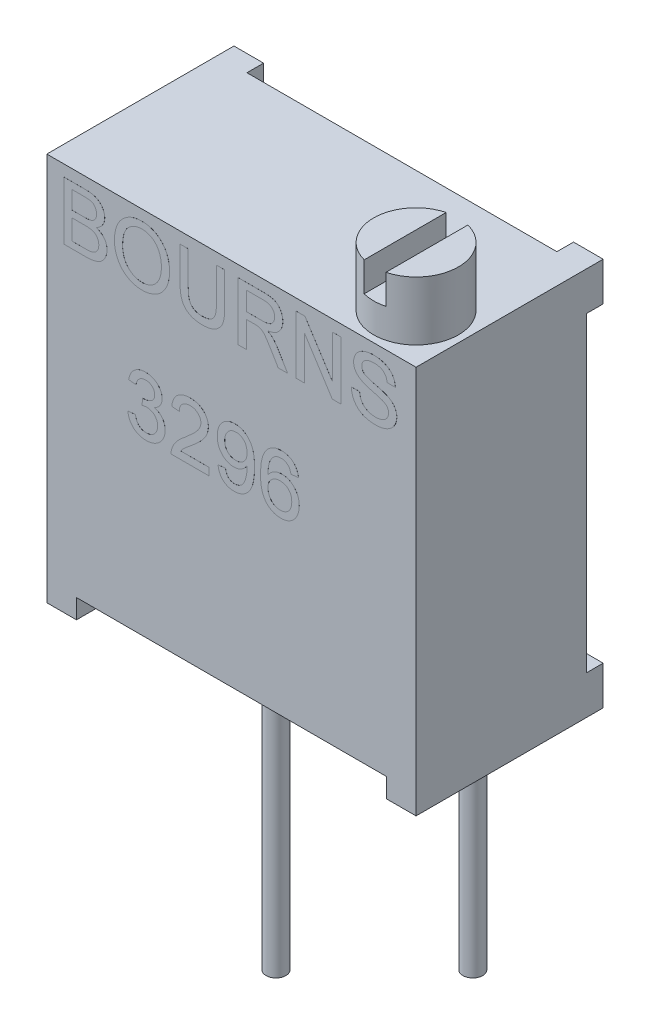
from build123d import *

# Parameters (mm, degrees)
SKETCH1_W          = 9.53
SKETCH1_H          = 10.03
EXTRUDE1_DEPTH     = 4.4
SKETCH2_W          = 8
SKETCH2_H          = 0.5
CUT_EXTRUDE1_DEPTH = 12.94429257
SKETCH3_W          = 0.765
SKETCH3_H          = 1
EXTRUDE2_DEPTH     = 0.43
SKETCH5_R          = 1.095
EXTRUDE4_DEPTH     = 1.52
SKETCH6_W          = 0.56
SKETCH6_H          = 3.177194403
CUT_EXTRUDE2_DEPTH = 0.76
EXTRUDE5_DEPTH     = 0.001
SKETCH9_R          = 0.255
EXTRUDE7_DEPTH     = 6.9


with BuildPart() as part:
    # Sketch1 → Extrude1 (new body)
    with BuildSketch(Plane.XY):
        with Locations((0, 5.015)):
            Rectangle(SKETCH1_W, SKETCH1_H)
    extrude(amount=EXTRUDE1_DEPTH)

    # Sketch2 → Cut-Extrude1 (cut, through all)
    with BuildSketch(Plane.XY.offset(4.4)):
        with Locations((0, 0.25)):
            Rectangle(SKETCH2_W, SKETCH2_H)
    extrude(amount=-CUT_EXTRUDE1_DEPTH, mode=Mode.SUBTRACT)

    # Sketch3 → Extrude2 (add)
    with BuildSketch(Plane(origin=(0, 0, 0), x_dir=(-1, 0, 0), z_dir=(0, 0, -1))):
        with Locations((-4.3825, 0.5)):
            Rectangle(SKETCH3_W, SKETCH3_H)
        with Locations((4.3825, 0.5)):
            Rectangle(SKETCH3_W, SKETCH3_H)
        with Locations((4.3825, 9.53)):
            Rectangle(SKETCH3_W, SKETCH3_H)
        with Locations((-4.3825, 9.53)):
            Rectangle(SKETCH3_W, SKETCH3_H)
    extrude(amount=EXTRUDE2_DEPTH)

    # Sketch5 → Extrude4 (add)
    with BuildSketch(Plane(origin=(0, 10.03, 0), x_dir=(-1, 0, 0), z_dir=(0, 1, 0))):
        with Locations(Location((-3.495, 3.13, 0), (0, 0, 270))):
            Circle(SKETCH5_R)
    extrude(amount=EXTRUDE4_DEPTH)

    # Sketch6 → Cut-Extrude2 (cut)
    with BuildSketch(Plane(origin=(0, 11.55, 0), x_dir=(-1, 0, 0), z_dir=(0, 1, 0))):
        with Locations((-3.495, 3.181606458)):
            Rectangle(SKETCH6_W, SKETCH6_H)
    extrude(amount=-CUT_EXTRUDE2_DEPTH, mode=Mode.SUBTRACT)

    # Sketch7 → Extrude5 (add)
    # profile 1 of 10: a face of its own
    with BuildSketch(Plane.XY.offset(4.4)):
        with BuildLine():
            Line((-4.326444342, 8.237150921), (-4.326444342, 9.737150921))
            Line((-4.326444342, 9.737150921), (-3.764845784, 9.737150921))
            add(Edge.make_bspline(
                [(-3.764845784, 9.737150921), (-3.750919069, 9.737097495), (-3.723744088, 9.736993245), (-3.684062996, 9.734386066), (-3.64648204, 9.730819986), (-3.610920315, 9.726223199), (-3.577531697, 9.719553354), (-3.5463473, 9.711473284), (-3.517204841, 9.702153183), (-3.481582627, 9.687955652), (-3.44053193, 9.666102632), (-3.396562734, 9.63349448), (-3.358307825, 9.594343785), (-3.326829661, 9.549455296), (-3.300895048, 9.501505925), (-3.282507712, 9.451409151), (-3.270751692, 9.400255705), (-3.269417834, 9.365618225), (-3.268752034, 9.348328806)],
                knots=[0, 0, 0, 0, 0.939712594, 1.833646414, 2.682508961, 3.487467313, 4.25240329, 4.978730417, 5.660668875, 6.315918528, 7.564895217, 8.787077865, 9.996481721, 11.241996224, 12.475862915, 13.665015424, 14.834484263, 16, 16, 16, 16], degree=3))
            add(Edge.make_bspline(
                [(-3.268752034, 9.348328806), (-3.26945193, 9.332243346), (-3.270844975, 9.300227505), (-3.281932051, 9.253066225), (-3.29943085, 9.207272915), (-3.324174647, 9.163404285), (-3.35580032, 9.122262901), (-3.395007125, 9.085240754), (-3.441231661, 9.052258501), (-3.475923175, 9.03467799), (-3.49381213, 9.025612459)],
                knots=[0, 0, 0, 0, 0.926741525, 1.844548388, 2.778836836, 3.746021974, 4.738420572, 5.759761325, 6.844803049, 8, 8, 8, 8], degree=3))
            add(Edge.make_bspline(
                [(-3.49381213, 9.025612459), (-3.482745904, 9.022148256), (-3.461080115, 9.015365935), (-3.429933293, 9.002955239), (-3.40069594, 8.988823885), (-3.373304413, 8.972948652), (-3.347943795, 8.955182527), (-3.324685642, 8.935497814), (-3.303368694, 8.914199128), (-3.284031035, 8.891299426), (-3.267044931, 8.866946071), (-3.251810517, 8.841671332), (-3.2392306, 8.815170846), (-3.228919301, 8.787513414), (-3.220874955, 8.758869935), (-3.215098238, 8.729130241), (-3.211805658, 8.698363557), (-3.211311122, 8.677463121), (-3.211059726, 8.666838421)],
                knots=[0, 0, 0, 0, 1.127427615, 2.20731145, 3.257257018, 4.283066884, 5.282973838, 6.264540225, 7.242620376, 8.210460609, 9.17525685, 10.12748095, 11.077310519, 12.023587065, 12.994999128, 13.967387486, 14.966724908, 16, 16, 16, 16], degree=3))
            add(Edge.make_bspline(
                [(-3.211059726, 8.666838421), (-3.211577892, 8.649780613), (-3.212604959, 8.615969962), (-3.220853456, 8.56620637), (-3.234792977, 8.518337989), (-3.253979542, 8.473138792), (-3.276841107, 8.43134548), (-3.302824076, 8.394052338), (-3.331265831, 8.36164311), (-3.362967261, 8.334381157), (-3.397723879, 8.311243736), (-3.436517359, 8.291760514), (-3.479047757, 8.27457818), (-3.526179479, 8.260852297), (-3.577891071, 8.249948474), (-3.634884306, 8.242864242), (-3.697246747, 8.237792882), (-3.74069542, 8.237370888), (-3.76334338, 8.237150921)],
                knots=[0, 0, 0, 0, 1.028073207, 2.037766189, 3.031549473, 4.027532207, 4.992436545, 5.898794514, 6.762903869, 7.584966804, 8.412380356, 9.273953678, 10.198004568, 11.174406109, 12.229717296, 13.381036288, 14.634844708, 16, 16, 16, 16], degree=3))
            Line((-3.76334338, 8.237150921), (-4.326444342, 8.237150921))
        make_face()
        with BuildLine():
            Line((-4.11490588, 9.102535536), (-3.805711169, 9.102535536))
            add(Edge.make_bspline(
                [(-3.805711169, 9.102535536), (-3.795593548, 9.102575565), (-3.776155313, 9.10265247), (-3.748116122, 9.103724756), (-3.722237293, 9.104639569), (-3.698618928, 9.106935678), (-3.677144021, 9.109184615), (-3.65789851, 9.112212035), (-3.640788132, 9.115623251), (-3.630311444, 9.11878741), (-3.625422707, 9.120263902)],
                knots=[0, 0, 0, 0, 1.335841395, 2.566453063, 3.705076039, 4.753984432, 5.69893722, 6.555639608, 7.326018133, 8, 8, 8, 8], degree=3))
            add(Edge.make_bspline(
                [(-3.625422707, 9.120263902), (-3.613935929, 9.124287721), (-3.591791825, 9.132044802), (-3.562116654, 9.149661914), (-3.536842034, 9.170802362), (-3.516035695, 9.195839435), (-3.500047055, 9.224639144), (-3.48819194, 9.256604254), (-3.481701001, 9.292181608), (-3.480773445, 9.316853252), (-3.480290496, 9.329698998)],
                knots=[0, 0, 0, 0, 1.059015028, 2.041559358, 2.989777133, 3.920090524, 4.862499371, 5.848878527, 6.879979022, 8, 8, 8, 8], degree=3))
            add(Edge.make_bspline(
                [(-3.480290496, 9.329698998), (-3.480678819, 9.342044591), (-3.481435618, 9.366104727), (-3.487788265, 9.401044217), (-3.498781285, 9.433548996), (-3.513668845, 9.463611935), (-3.532520451, 9.490357237), (-3.555020501, 9.513351936), (-3.581973973, 9.530734916), (-3.607167395, 9.541578455), (-3.629826882, 9.548362111), (-3.650072338, 9.552375722), (-3.673036723, 9.555912112), (-3.698795607, 9.558918633), (-3.727358734, 9.56125197), (-3.758814112, 9.563105652), (-3.793086864, 9.56389268), (-3.816828774, 9.564012054), (-3.829148669, 9.564073998)],
                knots=[0, 0, 0, 0, 1.216168307, 2.37017178, 3.484610845, 4.588286376, 5.664695412, 6.69777344, 7.738183022, 8.803673002, 9.390844981, 10.0665252, 10.835811589, 11.680682236, 12.621801058, 13.660007223, 14.785756265, 16, 16, 16, 16], degree=3))
            Line((-3.829148669, 9.564073998), (-4.11490588, 9.564073998))
            Line((-4.11490588, 9.564073998), (-4.11490588, 9.102535536))
        make_face(mode=Mode.SUBTRACT)
        with BuildLine():
            Line((-4.11490588, 8.410227844), (-3.760038092, 8.410227844))
            add(Edge.make_bspline(
                [(-3.760038092, 8.410227844), (-3.745915172, 8.410390096), (-3.719967473, 8.410688199), (-3.68447609, 8.41162336), (-3.655788079, 8.41390761), (-3.639035797, 8.416367164), (-3.631732803, 8.417439383)],
                knots=[0, 0, 0, 0, 1.317581857, 2.420761387, 3.311546315, 4, 4, 4, 4], degree=3))
            add(Edge.make_bspline(
                [(-3.631732803, 8.417439383), (-3.621262478, 8.419640139), (-3.60098922, 8.423901372), (-3.572408792, 8.433412), (-3.546204152, 8.444306931), (-3.522832664, 8.458153179), (-3.501191226, 8.47411003), (-3.482383206, 8.494040902), (-3.465060127, 8.516685746), (-3.450051204, 8.542600195), (-3.43791431, 8.571268479), (-3.42863829, 8.602247654), (-3.423697206, 8.635429101), (-3.422969697, 8.658209966), (-3.422598188, 8.669843229)],
                knots=[0, 0, 0, 0, 1.067651492, 2.067249321, 3.003744366, 3.895862395, 4.774133402, 5.679610569, 6.621910665, 7.616993802, 8.661192143, 9.724711987, 10.838102842, 12, 12, 12, 12], degree=3))
            add(Edge.make_bspline(
                [(-3.422598188, 8.669843229), (-3.42301209, 8.683501376), (-3.42381924, 8.710136157), (-3.431491485, 8.748624765), (-3.444164778, 8.784323428), (-3.462005081, 8.816737755), (-3.483887144, 8.845891651), (-3.51036223, 8.870622107), (-3.541232376, 8.890246947), (-3.576592458, 8.905648649), (-3.617921311, 8.916606694), (-3.666359943, 8.924041064), (-3.722683143, 8.928838285), (-3.762931606, 8.929242981), (-3.784377034, 8.929458613)],
                knots=[0, 0, 0, 0, 0.96167883, 1.875371887, 2.752872588, 3.621584364, 4.472914353, 5.312011319, 6.159851575, 7.038572308, 8.019870099, 9.164119506, 10.488969081, 12, 12, 12, 12], degree=3))
            Line((-3.784377034, 8.929458613), (-4.11490588, 8.929458613))
            Line((-4.11490588, 8.929458613), (-4.11490588, 8.410227844))
        make_face(mode=Mode.SUBTRACT)
    # profile 2 of 10: a face of its own
    with BuildSketch(Plane.XY.offset(4.4)):
        with BuildLine():
            add(Edge.make_bspline(
                [(-3.018752034, 8.96731919), (-3.018230692, 8.997392897), (-3.017214883, 9.055989991), (-3.007723632, 9.141314909), (-2.992312277, 9.221594495), (-2.970280381, 9.296822497), (-2.942354889, 9.367116795), (-2.90840612, 9.432636561), (-2.867412916, 9.492640158), (-2.821039156, 9.547698782), (-2.769241797, 9.596374641), (-2.714092331, 9.639605778), (-2.654902115, 9.675665657), (-2.592218021, 9.705439229), (-2.525773732, 9.728298516), (-2.455755803, 9.744302096), (-2.382239117, 9.754625961), (-2.331988742, 9.755787946), (-2.30631213, 9.75638169)],
                knots=[0, 0, 0, 0, 1.203621547, 2.345195544, 3.432004029, 4.472479546, 5.478447225, 6.455936844, 7.420185704, 8.381829745, 9.332027588, 10.260832629, 11.182364398, 12.100723901, 13.034044877, 13.989196293, 14.972532542, 16, 16, 16, 16], degree=3))
            add(Edge.make_bspline(
                [(-2.30631213, 9.75638169), (-2.289376641, 9.756085965), (-2.255745821, 9.755498707), (-2.206025657, 9.751030463), (-2.157583125, 9.74305542), (-2.110465931, 9.732367968), (-2.064545821, 9.718346497), (-2.019795371, 9.701794576), (-1.976606323, 9.681284416), (-1.934691352, 9.658321251), (-1.894545231, 9.632635958), (-1.856816008, 9.604261466), (-1.821594055, 9.573412372), (-1.788406246, 9.540595749), (-1.758360012, 9.504704083), (-1.730214065, 9.466830696), (-1.704777197, 9.426304031), (-1.681959152, 9.383456134), (-1.661557501, 9.338948785), (-1.644120351, 9.292597519), (-1.629147388, 9.24495835), (-1.616613755, 9.195749307), (-1.607620535, 9.144987212), (-1.600459136, 9.092890794), (-1.596689895, 9.039289785), (-1.596016226, 9.003081348), (-1.595675111, 8.984747075)],
                knots=[0, 0, 0, 0, 1.034375294, 2.054082248, 3.045783978, 4.031219655, 5.002789406, 5.976610191, 6.94273282, 7.920236376, 8.894345378, 9.851183672, 10.800797181, 11.752517031, 12.698794154, 13.65688337, 14.632873302, 15.61821402, 16.620222298, 17.621258913, 18.640965868, 19.669244166, 20.720417492, 21.788124603, 22.880008887, 24, 24, 24, 24], degree=3))
            add(Edge.make_bspline(
                [(-1.595675111, 8.984747075), (-1.595987646, 8.966110469), (-1.596605114, 8.929290641), (-1.600783152, 8.87489649), (-1.608129594, 8.822063882), (-1.617873399, 8.77063528), (-1.630929801, 8.720717747), (-1.646445328, 8.672168168), (-1.665212234, 8.625275712), (-1.686407371, 8.579927361), (-1.71038966, 8.536746809), (-1.736843752, 8.496035998), (-1.765788388, 8.458175743), (-1.796783902, 8.422701596), (-1.830554122, 8.390247902), (-1.866683213, 8.360511195), (-1.90503226, 8.333211022), (-1.945730096, 8.30908676), (-1.988046343, 8.287940982), (-2.031143628, 8.269180868), (-2.075053966, 8.253181495), (-2.119927428, 8.240215594), (-2.165641605, 8.230417626), (-2.21206785, 8.223080805), (-2.259358356, 8.218856237), (-2.291179863, 8.218233784), (-2.307213572, 8.217920152)],
                knots=[0, 0, 0, 0, 1.141429366, 2.255090526, 3.338676798, 4.407031443, 5.458968682, 6.496860253, 7.526652771, 8.550250826, 9.560787671, 10.54935636, 11.521089193, 12.477323897, 13.431786008, 14.386110112, 15.340986122, 16.312041, 17.28047646, 18.236612773, 19.189437236, 20.140779471, 21.09494583, 22.051062463, 23.018000708, 24, 24, 24, 24], degree=3))
            add(Edge.make_bspline(
                [(-2.307213572, 8.217920152), (-2.324453371, 8.218175217), (-2.358601094, 8.218680436), (-2.409072348, 8.223723391), (-2.458287957, 8.231416594), (-2.506104842, 8.242523255), (-2.552457663, 8.25701268), (-2.597401266, 8.27455022), (-2.641093722, 8.294901493), (-2.682992881, 8.318649222), (-2.722956135, 8.345054144), (-2.760596145, 8.373985002), (-2.795892098, 8.405175171), (-2.828277639, 8.439140188), (-2.858801633, 8.474648809), (-2.886243593, 8.513020865), (-2.911499732, 8.55338612), (-2.933822678, 8.596133677), (-2.95398812, 8.639993241), (-2.97097794, 8.68497884), (-2.985908699, 8.730427507), (-2.997799537, 8.776619369), (-3.007275088, 8.823447871), (-3.01364671, 8.870835093), (-3.018248343, 8.918851609), (-3.018583292, 8.951082028), (-3.018752034, 8.96731919)],
                knots=[0, 0, 0, 0, 1.072727997, 2.12480551, 3.153819198, 4.171534612, 5.177148798, 6.173931848, 7.17235114, 8.174500385, 9.168706755, 10.151274001, 11.127173509, 12.097141049, 13.070188938, 14.039134204, 15.03036519, 16.031505612, 17.038625933, 18.033164522, 19.022845559, 20.014762458, 21.000193215, 21.994692725, 22.989758729, 24, 24, 24, 24], degree=3))
        make_face()
        with BuildLine():
            add(Edge.make_bspline(
                [(-2.807213572, 8.964915344), (-2.8068894, 8.943259561), (-2.806257286, 8.901032314), (-2.799025562, 8.839467232), (-2.788052575, 8.781377442), (-2.772927471, 8.726599873), (-2.752595628, 8.675676265), (-2.728286277, 8.628117292), (-2.699180916, 8.584239101), (-2.665921697, 8.544164434), (-2.629340369, 8.508164356), (-2.590249507, 8.476720203), (-2.548640324, 8.450387949), (-2.504974133, 8.428645052), (-2.458937298, 8.411672739), (-2.410667702, 8.399755208), (-2.360129877, 8.39230176), (-2.325669313, 8.391437388), (-2.308115015, 8.390997075)],
                knots=[0, 0, 0, 0, 1.215430442, 2.370003584, 3.475209778, 4.53279855, 5.55522989, 6.548792651, 7.526809858, 8.505409025, 9.467826767, 10.404123909, 11.316848639, 12.227335424, 13.138360512, 14.065900994, 15.014765094, 16, 16, 16, 16], degree=3))
            add(Edge.make_bspline(
                [(-2.308115015, 8.390997075), (-2.290263171, 8.3914439), (-2.25530931, 8.392318784), (-2.204009559, 8.399642118), (-2.155269053, 8.412109783), (-2.108604686, 8.42870707), (-2.064860106, 8.451143772), (-2.02301225, 8.477417027), (-1.984201898, 8.509522192), (-1.947476365, 8.54558594), (-1.914536035, 8.586579013), (-1.885308427, 8.631491621), (-1.861565976, 8.680997339), (-1.841067574, 8.734005623), (-1.826057462, 8.791518352), (-1.81496407, 8.85288172), (-1.808278957, 8.918293114), (-1.80757498, 8.963196823), (-1.807213572, 8.986249479)],
                knots=[0, 0, 0, 0, 0.976878588, 1.912725521, 2.8289017, 3.727303729, 4.617335839, 5.514666588, 6.426584173, 7.368641557, 8.327632997, 9.299405846, 10.294892156, 11.327373912, 12.405931897, 13.542618837, 14.738430195, 16, 16, 16, 16], degree=3))
            add(Edge.make_bspline(
                [(-1.807213572, 8.986249479), (-1.807341294, 9.001080057), (-1.807591837, 9.030172285), (-1.810909864, 9.073054562), (-1.815189695, 9.114602954), (-1.821705802, 9.15476385), (-1.830685826, 9.193370934), (-1.840634167, 9.230718122), (-1.853074219, 9.266483577), (-1.867189192, 9.300807558), (-1.882983608, 9.333513851), (-1.900797609, 9.36432673), (-1.920424159, 9.3931264), (-1.941333711, 9.420458875), (-1.964684118, 9.445266276), (-1.989351045, 9.468596479), (-2.015894798, 9.489967476), (-2.044050482, 9.509384851), (-2.073418672, 9.526863548), (-2.103938825, 9.541823045), (-2.135124711, 9.554963084), (-2.167498339, 9.565035475), (-2.200612691, 9.573159006), (-2.234601633, 9.579329585), (-2.269591323, 9.582524997), (-2.293185557, 9.583042977), (-2.305110207, 9.583304767)],
                knots=[0, 0, 0, 0, 1.220438779, 2.394059227, 3.538503547, 4.658058814, 5.74010225, 6.800155734, 7.837851593, 8.854470756, 9.853724944, 10.825214244, 11.781044712, 12.72106398, 13.654479919, 14.581868691, 15.514082315, 16.456304431, 17.39516604, 18.324312202, 19.252140633, 20.177768678, 21.111585046, 22.057694709, 23.018348693, 24, 24, 24, 24], degree=3))
            add(Edge.make_bspline(
                [(-2.305110207, 9.583304767), (-2.321964073, 9.582970056), (-2.355218629, 9.582309634), (-2.404173295, 9.574968014), (-2.4513709, 9.56399863), (-2.496884691, 9.548662848), (-2.540325395, 9.528355862), (-2.581918075, 9.503452123), (-2.622031926, 9.47462972), (-2.660034411, 9.441186401), (-2.695461039, 9.402768193), (-2.725410699, 9.357474302), (-2.750653091, 9.30638599), (-2.771730023, 9.249632752), (-2.787800563, 9.186775074), (-2.798907316, 9.11808346), (-2.805919894, 9.043485528), (-2.806771322, 8.991774955), (-2.807213572, 8.964915344)],
                knots=[0, 0, 0, 0, 0.895090134, 1.766112571, 2.624765742, 3.468151641, 4.313618154, 5.168136083, 6.041303099, 6.935189387, 7.854749729, 8.809996334, 9.809869957, 10.877771942, 12.021723904, 13.25217762, 14.572720513, 16, 16, 16, 16], degree=3))
        make_face(mode=Mode.SUBTRACT)
    # profile 3 of 10: a face of its own
    with BuildSketch(Plane.XY.offset(4.4)):
        with BuildLine():
            Line((-0.384136649, 9.737150921), (-0.172598188, 9.737150921))
            Line((-0.172598188, 9.737150921), (-0.172598188, 8.874170152))
            add(Edge.make_bspline(
                [(-0.172598188, 8.874170152), (-0.172817713, 8.855839279), (-0.17324491, 8.820167371), (-0.175210197, 8.768143941), (-0.179038667, 8.719011196), (-0.184899968, 8.672848597), (-0.19152619, 8.629455925), (-0.200351288, 8.589070404), (-0.210472953, 8.551529041), (-0.222118871, 8.516578197), (-0.236215171, 8.483981753), (-0.252320236, 8.453041696), (-0.27110134, 8.423667691), (-0.292509773, 8.395904321), (-0.316659126, 8.369903341), (-0.342889972, 8.34499824), (-0.371894747, 8.32187367), (-0.403354379, 8.300264922), (-0.437307933, 8.280653275), (-0.473904053, 8.263733066), (-0.513098094, 8.24978275), (-0.554713075, 8.237914738), (-0.59895675, 8.229115881), (-0.645687182, 8.222441781), (-0.694966239, 8.218516166), (-0.728680904, 8.218121765), (-0.745915496, 8.217920152)],
                knots=[0, 0, 0, 0, 1.311435591, 2.552055809, 3.723716842, 4.835547674, 5.880436826, 6.862821995, 7.791032428, 8.661143393, 9.495683908, 10.328993084, 11.1538804, 11.986573222, 12.833449924, 13.690091648, 14.571895854, 15.484149563, 16.418232274, 17.373591634, 18.364096258, 19.391643703, 20.466661433, 21.588422397, 22.767226238, 24, 24, 24, 24], degree=3))
            add(Edge.make_bspline(
                [(-0.745915496, 8.217920152), (-0.762747176, 8.218167913), (-0.795542393, 8.218650658), (-0.843600901, 8.221914973), (-0.889315102, 8.227699697), (-0.932822961, 8.235291305), (-0.973978437, 8.245579942), (-1.01272043, 8.258173326), (-1.049181209, 8.272904412), (-1.083365134, 8.2896649), (-1.11487259, 8.309015777), (-1.144260591, 8.330138013), (-1.171397739, 8.353261603), (-1.19603194, 8.378594967), (-1.218455258, 8.405756623), (-1.238355176, 8.435036855), (-1.255779343, 8.466487887), (-1.271165901, 8.500026899), (-1.284571795, 8.536147585), (-1.295381776, 8.575342209), (-1.305161568, 8.617510171), (-1.312667758, 8.662804669), (-1.319261137, 8.711168829), (-1.323084681, 8.762745583), (-1.325997838, 8.817446196), (-1.326292931, 8.854934905), (-1.326444342, 8.874170152)],
                knots=[0, 0, 0, 0, 1.192889473, 2.324252067, 3.41162405, 4.457325556, 5.452435892, 6.415456921, 7.342133401, 8.237363544, 9.110250727, 9.959377435, 10.800155199, 11.633438097, 12.46053001, 13.293359256, 14.138649731, 15.005774073, 15.906391469, 16.865847877, 17.8852706, 18.972920589, 20.118424796, 21.343408205, 22.636917643, 24, 24, 24, 24], degree=3))
            Line((-1.326444342, 8.874170152), (-1.326444342, 9.737150921))
            Line((-1.326444342, 9.737150921), (-1.11490588, 9.737150921))
            Line((-1.11490588, 9.737150921), (-1.11490588, 8.884086017))
            add(Edge.make_bspline(
                [(-1.11490588, 8.884086017), (-1.114767658, 8.868560422), (-1.114500957, 8.838603557), (-1.113109482, 8.795207672), (-1.110326775, 8.754936554), (-1.106886612, 8.717728723), (-1.102157025, 8.683718544), (-1.09610028, 8.652955825), (-1.089306625, 8.625335805), (-1.079133218, 8.593035516), (-1.062246323, 8.556979041), (-1.035633784, 8.518762127), (-1.003161194, 8.485560874), (-0.964517851, 8.458141879), (-0.920633994, 8.436355447), (-0.871805449, 8.421333433), (-0.818611502, 8.411672805), (-0.781617528, 8.410721136), (-0.762441938, 8.410227844)],
                knots=[0, 0, 0, 0, 1.090245215, 2.103644224, 3.048223674, 3.924421557, 4.727106666, 5.45815927, 6.12513286, 6.723455763, 7.834131158, 8.905266051, 9.9795367, 11.078391299, 12.21701853, 13.404826756, 14.65480846, 16, 16, 16, 16], degree=3))
            add(Edge.make_bspline(
                [(-0.762441938, 8.410227844), (-0.746007063, 8.410507631), (-0.714272984, 8.411047872), (-0.668513344, 8.415404728), (-0.6265627, 8.423347367), (-0.588072882, 8.433582839), (-0.553314751, 8.447483141), (-0.522075787, 8.464324146), (-0.494465601, 8.484196483), (-0.470286071, 8.507638528), (-0.449452221, 8.535691341), (-0.431893065, 8.569123488), (-0.416934773, 8.607964106), (-0.404676645, 8.652341416), (-0.395738752, 8.702466188), (-0.388751711, 8.758015588), (-0.385088051, 8.819233831), (-0.384462913, 8.861846319), (-0.384136649, 8.884086017)],
                knots=[0, 0, 0, 0, 1.111629428, 2.146443922, 3.104513091, 3.997025448, 4.836178689, 5.630482806, 6.392099463, 7.129930272, 7.899580577, 8.745272349, 9.676297551, 10.710246713, 11.854352966, 13.117392195, 14.495550762, 16, 16, 16, 16], degree=3))
            Line((-0.384136649, 8.884086017), (-0.384136649, 9.737150921))
        make_face()
    # profile 4 of 10: a face of its own
    with BuildSketch(Plane.XY.offset(4.4)):
        with BuildLine():
            Line((0.173555658, 8.237150921), (0.173555658, 9.737150921))
            Line((0.173555658, 9.737150921), (0.824397004, 9.737150921))
            add(Edge.make_bspline(
                [(0.824397004, 9.737150921), (0.839722325, 9.737030841), (0.86938269, 9.73679844), (0.912396343, 9.735153303), (0.952545276, 9.731606819), (0.98990331, 9.727771792), (1.024463806, 9.721885537), (1.05619111, 9.715134136), (1.085134208, 9.707099866), (1.111422492, 9.697610774), (1.135812287, 9.686875288), (1.158419785, 9.673629431), (1.18018475, 9.659114797), (1.200299409, 9.642062268), (1.219294287, 9.623391327), (1.237151779, 9.602848275), (1.25360752, 9.580254841), (1.273903706, 9.547918952), (1.295677375, 9.504854357), (1.313818262, 9.449741006), (1.325515181, 9.39209043), (1.326766785, 9.352692939), (1.327401812, 9.332703806)],
                knots=[0, 0, 0, 0, 1.242255013, 2.404239178, 3.487702428, 4.508875116, 5.447164253, 6.327763259, 7.137389581, 7.87956647, 8.591787438, 9.293660819, 10.000726923, 10.709654955, 11.427269343, 12.158170644, 12.913245971, 13.690346794, 15.251572448, 16.809945773, 18.381459854, 20, 20, 20, 20], degree=3))
            add(Edge.make_bspline(
                [(1.327401812, 9.332703806), (1.327108288, 9.319872565), (1.326528558, 9.294529983), (1.322087769, 9.257269606), (1.314052519, 9.221668814), (1.303748895, 9.187415821), (1.289646376, 9.154995938), (1.273309221, 9.123746979), (1.253069809, 9.094527437), (1.230409548, 9.066559241), (1.204424306, 9.040441395), (1.17488549, 9.017116168), (1.142085913, 8.99613508), (1.105871101, 8.978077007), (1.066657924, 8.96157107), (1.023954363, 8.948279695), (0.977932767, 8.937426268), (0.946028457, 8.93217062), (0.929565274, 8.929458613)],
                knots=[0, 0, 0, 0, 0.982609109, 1.940720374, 2.867584677, 3.775009516, 4.675469332, 5.571146231, 6.471115823, 7.392408543, 8.32534739, 9.286126426, 10.269214477, 11.301811357, 12.381622301, 13.524260118, 14.722474812, 16, 16, 16, 16], degree=3))
            add(Edge.make_bspline(
                [(0.929565274, 8.929458613), (0.941641642, 8.923357898), (0.964575101, 8.911772421), (0.996326759, 8.893606493), (1.02324154, 8.875045391), (1.038834637, 8.861769945), (1.046151812, 8.855540344)],
                knots=[0, 0, 0, 0, 1.172304973, 2.226249348, 3.167654437, 4, 4, 4, 4], degree=3))
            add(Edge.make_bspline(
                [(1.046151812, 8.855540344), (1.060321936, 8.841649482), (1.089428377, 8.813116664), (1.129538316, 8.764516917), (1.16842628, 8.710417941), (1.192053651, 8.671320427), (1.204204697, 8.651213421)],
                knots=[0, 0, 0, 0, 0.918110279, 1.885863737, 2.912745394, 4, 4, 4, 4], degree=3))
            Line((1.204204697, 8.651213421), (1.450298447, 8.237150921))
            Line((1.450298447, 8.237150921), (1.207810466, 8.237150921))
            Line((1.207810466, 8.237150921), (1.020911428, 8.553857652))
            add(Edge.make_bspline(
                [(1.020911428, 8.553857652), (1.014191477, 8.564969688), (1.001169316, 8.58650299), (0.982359271, 8.617951341), (0.96391664, 8.646904558), (0.946811416, 8.674190141), (0.930349439, 8.699312734), (0.914689771, 8.722359607), (0.900263372, 8.743633105), (0.882394413, 8.768400992), (0.861597912, 8.79580689), (0.837329822, 8.82402979), (0.814219405, 8.846531531), (0.7857585, 8.868596883), (0.750505364, 8.88923531), (0.720539532, 8.898718101), (0.706007581, 8.903316786)],
                knots=[0, 0, 0, 0, 1.130940588, 2.191577161, 3.191089816, 4.120344442, 4.99615009, 5.80661983, 6.546979556, 7.234477901, 8.466216387, 9.541989141, 10.473533583, 11.269175393, 12.675684693, 14, 14, 14, 14], degree=3))
            add(Edge.make_bspline(
                [(0.706007581, 8.903316786), (0.699910513, 8.904416295), (0.685990724, 8.906926506), (0.662354957, 8.908565929), (0.633717326, 8.910305957), (0.612963146, 8.910255258), (0.601740754, 8.910227844)],
                knots=[0, 0, 0, 0, 0.709978628, 1.620902492, 2.713552433, 4, 4, 4, 4], degree=3))
            Line((0.601740754, 8.910227844), (0.38509412, 8.910227844))
            Line((0.38509412, 8.910227844), (0.38509412, 8.237150921))
            Line((0.38509412, 8.237150921), (0.173555658, 8.237150921))
        make_face()
        with BuildLine():
            Line((0.38509412, 9.083304767), (0.786836908, 9.083304767))
            add(Edge.make_bspline(
                [(0.786836908, 9.083304767), (0.806981813, 9.083619953), (0.844640824, 9.084209164), (0.897300993, 9.089240406), (0.942179174, 9.097235264), (0.980162544, 9.108896699), (1.012074571, 9.125086645), (1.039829066, 9.144817119), (1.062893402, 9.169531591), (1.082080546, 9.197416611), (1.096995107, 9.228102684), (1.10775376, 9.260333904), (1.114795486, 9.29383939), (1.115504243, 9.31664276), (1.115863351, 9.328196594)],
                knots=[0, 0, 0, 0, 1.546323217, 2.890706218, 4.056530419, 5.041445823, 5.928701482, 6.793137403, 7.641659452, 8.509781392, 9.383301667, 10.251423607, 11.114044887, 12, 12, 12, 12], degree=3))
            add(Edge.make_bspline(
                [(1.115863351, 9.328196594), (1.115584159, 9.336616312), (1.115037306, 9.353108067), (1.11217052, 9.377313385), (1.106596807, 9.400314031), (1.099236732, 9.422231591), (1.089402179, 9.442905533), (1.07771913, 9.462496058), (1.063777647, 9.480894587), (1.047808481, 9.498157164), (1.029472975, 9.513864423), (1.008529518, 9.52741638), (0.985143287, 9.538932621), (0.959287102, 9.548072679), (0.931042413, 9.555383237), (0.90024843, 9.560246716), (0.86704598, 9.563765913), (0.844038607, 9.563969384), (0.832209504, 9.564073998)],
                knots=[0, 0, 0, 0, 0.965208469, 1.890559848, 2.786986821, 3.67262109, 4.535197034, 5.405224191, 6.282113641, 7.175449223, 8.095446547, 9.040936516, 10.026471658, 11.075712529, 12.17809725, 13.364958037, 14.645208957, 16, 16, 16, 16], degree=3))
            Line((0.832209504, 9.564073998), (0.38509412, 9.564073998))
            Line((0.38509412, 9.564073998), (0.38509412, 9.083304767))
        make_face(mode=Mode.SUBTRACT)
    # profile 5 of 10: a face of its own
    with BuildSketch(Plane.XY.offset(4.4)):
        Polygon((1.673555658, 8.237150921), (1.673555658, 9.737150921), (1.897113351, 9.737150921), (2.615863351, 8.617860056), (2.615863351, 9.737150921), (2.827401812, 9.737150921), (2.827401812, 8.237150921), (2.60384412, 8.237150921), (1.88509412, 9.356441786), (1.88509412, 8.237150921), align=None)
    # profile 6 of 10: a face of its own
    with BuildSketch(Plane.XY.offset(4.4)):
        with BuildLine():
            Line((3.096632581, 8.75638169), (3.308171043, 8.75638169))
            add(Edge.make_bspline(
                [(3.308171043, 8.75638169), (3.310497843, 8.737388445), (3.314967752, 8.700901399), (3.327466063, 8.649186503), (3.343552197, 8.602689505), (3.363595075, 8.560793306), (3.389960718, 8.52400024), (3.421726783, 8.490813457), (3.460304939, 8.462075712), (3.503850884, 8.436501001), (3.552348913, 8.416420809), (3.604124885, 8.401535032), (3.658931873, 8.39271509), (3.696460325, 8.391577796), (3.715622966, 8.390997075)],
                knots=[0, 0, 0, 0, 1.125557648, 2.162256852, 3.1243583, 4.018160113, 4.88511607, 5.777380551, 6.711250965, 7.707237736, 8.743031335, 9.791730543, 10.872421559, 12, 12, 12, 12], degree=3))
            add(Edge.make_bspline(
                [(3.715622966, 8.390997075), (3.732580253, 8.391310936), (3.765643678, 8.391922905), (3.813473618, 8.399274166), (3.858481731, 8.409701733), (3.899830369, 8.42547506), (3.937367, 8.444628825), (3.969963359, 8.467795753), (3.997792396, 8.493921683), (4.019584549, 8.523694759), (4.03670403, 8.554891964), (4.049262938, 8.586959473), (4.056744023, 8.619719296), (4.057697308, 8.641761795), (4.058171043, 8.652715825)],
                knots=[0, 0, 0, 0, 1.267006637, 2.470417599, 3.611360613, 4.716023143, 5.771382139, 6.754486395, 7.697536124, 8.612899418, 9.501261124, 10.352596716, 11.181322154, 12, 12, 12, 12], degree=3))
            add(Edge.make_bspline(
                [(4.058171043, 8.652715825), (4.057664611, 8.663558897), (4.056674791, 8.684751666), (4.050224406, 8.71560569), (4.037964538, 8.743846084), (4.022055951, 8.770625489), (3.99992439, 8.795109454), (3.97196366, 8.817669243), (3.937557717, 8.838122166), (3.911878856, 8.849323379), (3.898315274, 8.855239863)],
                knots=[0, 0, 0, 0, 0.942140154, 1.841411588, 2.718743672, 3.605002079, 4.535543111, 5.568170452, 6.715506882, 8, 8, 8, 8], degree=3))
            add(Edge.make_bspline(
                [(3.898315274, 8.855239863), (3.893030701, 8.857408477), (3.881091893, 8.86230777), (3.860629335, 8.868793591), (3.836347919, 8.877180419), (3.807664303, 8.885817486), (3.774732043, 8.894954296), (3.737605968, 8.905295779), (3.696306823, 8.91629338), (3.652005924, 8.927999128), (3.607275516, 8.93990208), (3.564540836, 8.951816178), (3.5252229, 8.963910513), (3.488999639, 8.975555689), (3.456057801, 8.987248909), (3.42630389, 8.998670037), (3.39970081, 9.009587356), (3.383452661, 9.017614692), (3.375779216, 9.021405729)],
                knots=[0, 0, 0, 0, 0.499201778, 1.127787504, 1.87543728, 2.745208432, 3.745951656, 4.863402235, 6.114490242, 7.482339553, 8.869366102, 10.161191451, 11.360587006, 12.46547846, 13.487450326, 14.41601931, 15.251940103, 16, 16, 16, 16], degree=3))
            add(Edge.make_bspline(
                [(3.375779216, 9.021405729), (3.35812476, 9.030943175), (3.324047064, 9.049352927), (3.278182261, 9.082269616), (3.239536508, 9.118796776), (3.208272844, 9.158881439), (3.183772734, 9.201845678), (3.167242617, 9.247762533), (3.155920851, 9.295798527), (3.154862803, 9.328830804), (3.154324889, 9.345624479)],
                knots=[0, 0, 0, 0, 1.158441928, 2.236094408, 3.251151369, 4.220012324, 5.163146324, 6.095083285, 7.031536583, 8, 8, 8, 8], degree=3))
            add(Edge.make_bspline(
                [(3.154324889, 9.345624479), (3.155038808, 9.364220637), (3.156458787, 9.40120826), (3.169054782, 9.455485292), (3.189145635, 9.507714234), (3.212015126, 9.549179557), (3.234317935, 9.580535449), (3.252807132, 9.603117389), (3.273546383, 9.623991357), (3.295896991, 9.643448738), (3.320258496, 9.661198819), (3.346026486, 9.677971103), (3.374133618, 9.692387284), (3.413628319, 9.710735829), (3.466462713, 9.729058566), (3.532974606, 9.745024508), (3.60297619, 9.754426519), (3.650690914, 9.755720748), (3.675058062, 9.75638169)],
                knots=[0, 0, 0, 0, 1.199927478, 2.386647047, 3.578628709, 4.806592355, 5.433127754, 6.062729195, 6.689531802, 7.331674828, 7.974827539, 8.635320743, 9.315455226, 10.01318112, 11.447700238, 12.918145351, 14.426146008, 16, 16, 16, 16], degree=3))
            add(Edge.make_bspline(
                [(3.675058062, 9.75638169), (3.701729524, 9.755770554), (3.753664, 9.754580555), (3.829126262, 9.744679979), (3.899511893, 9.727678083), (3.954710721, 9.708646167), (3.995518568, 9.689378935), (4.024509599, 9.674344909), (4.051419009, 9.656962836), (4.076489036, 9.638152714), (4.099952547, 9.617923133), (4.121206478, 9.595792899), (4.141173733, 9.572517055), (4.16463804, 9.539100235), (4.189937537, 9.494873263), (4.211812397, 9.437575464), (4.22684068, 9.377102341), (4.229764027, 9.335295723), (4.231247966, 9.314073998)],
                knots=[0, 0, 0, 0, 1.607600973, 3.130308851, 4.577334065, 5.967726088, 6.640410691, 7.296826776, 7.935019992, 8.569057421, 9.185393759, 9.8003086, 10.417295362, 11.032210203, 12.259799365, 13.477607022, 14.719591916, 16, 16, 16, 16], degree=3))
            Line((4.231247966, 9.314073998), (4.019709504, 9.314073998))
            add(Edge.make_bspline(
                [(4.019709504, 9.314073998), (4.01836542, 9.324814934), (4.015735446, 9.345831762), (4.009210828, 9.376256782), (4.000064628, 9.404514172), (3.989351623, 9.43086745), (3.97636522, 9.455042515), (3.96122683, 9.477271498), (3.943752103, 9.497292505), (3.924390679, 9.515634568), (3.902553396, 9.531605384), (3.878352458, 9.545468544), (3.851747016, 9.557179739), (3.822760508, 9.566771589), (3.791387195, 9.574208735), (3.757555718, 9.579679641), (3.721279153, 9.582481538), (3.696296049, 9.583025524), (3.683471524, 9.583304767)],
                knots=[0, 0, 0, 0, 1.074487479, 2.102453544, 3.083708351, 4.020042547, 4.923259678, 5.803182661, 6.684453325, 7.556870173, 8.445961597, 9.363679789, 10.320905216, 11.327237703, 12.390948353, 13.519046902, 14.726457512, 16, 16, 16, 16], degree=3))
            add(Edge.make_bspline(
                [(3.683471524, 9.583304767), (3.670141028, 9.583204288), (3.644336467, 9.583009786), (3.607033047, 9.579464247), (3.572457599, 9.574599641), (3.54066951, 9.567423935), (3.511772912, 9.558030911), (3.48533894, 9.547184123), (3.462107376, 9.533438411), (3.441536651, 9.518127475), (3.423791796, 9.50118677), (3.40849836, 9.483335363), (3.394972496, 9.465097741), (3.384462602, 9.445477024), (3.375905969, 9.425216278), (3.370386, 9.403934666), (3.366477733, 9.382025845), (3.366070975, 9.367077017), (3.365863351, 9.359446594)],
                knots=[0, 0, 0, 0, 1.464176581, 2.834285765, 4.113735764, 5.29917439, 6.409476712, 7.449999357, 8.431575861, 9.367089851, 10.262376129, 11.120706676, 11.948504824, 12.751342953, 13.560717798, 14.359016663, 15.162382702, 16, 16, 16, 16], degree=3))
            add(Edge.make_bspline(
                [(3.365863351, 9.359446594), (3.366410016, 9.346541253), (3.367471042, 9.321493177), (3.378305676, 9.285907411), (3.394969419, 9.25346868), (3.411385861, 9.235818932), (3.419649408, 9.226934575)],
                knots=[0, 0, 0, 0, 1.050964922, 2.039826012, 3.013306874, 4, 4, 4, 4], degree=3))
            add(Edge.make_bspline(
                [(3.419649408, 9.226934575), (3.42485866, 9.222494598), (3.4363786, 9.212675865), (3.457813222, 9.19968192), (3.484388976, 9.186553195), (3.516283435, 9.173502227), (3.553441723, 9.160370577), (3.595803905, 9.146849929), (3.643531332, 9.133421398), (3.695169512, 9.120480787), (3.747336115, 9.107488153), (3.796911925, 9.094545037), (3.842430911, 9.082278526), (3.883820853, 9.070314553), (3.921124591, 9.058686949), (3.954212481, 9.0471521), (3.983352215, 9.036542966), (4.001203746, 9.029078573), (4.009493158, 9.025612459)],
                knots=[0, 0, 0, 0, 0.523891492, 1.158553688, 1.913783773, 2.794766643, 3.797521443, 4.933638669, 6.202080764, 7.596537849, 9.013317056, 10.322179469, 11.523240428, 12.626146501, 13.623953177, 14.517289671, 15.311498917, 16, 16, 16, 16], degree=3))
            add(Edge.make_bspline(
                [(4.009493158, 9.025612459), (4.020278105, 9.020639906), (4.041447148, 9.010879618), (4.071435932, 8.994215394), (4.099418721, 8.976910495), (4.125169432, 8.958499014), (4.148604802, 8.938942223), (4.169986865, 8.9184642), (4.189444761, 8.897180034), (4.206193367, 8.874408509), (4.221231896, 8.851070152), (4.23439161, 8.82683878), (4.244987559, 8.801571892), (4.254280868, 8.775574057), (4.260965422, 8.748556105), (4.266207461, 8.720790933), (4.269265054, 8.692148039), (4.269560074, 8.672754984), (4.269709504, 8.662932171)],
                knots=[0, 0, 0, 0, 1.198900896, 2.353241543, 3.461831299, 4.520043694, 5.547003373, 6.541368882, 7.508191797, 8.454912692, 9.392021408, 10.310662301, 11.235020644, 12.156274873, 13.095836685, 14.042125239, 15.00831306, 16, 16, 16, 16], degree=3))
            add(Edge.make_bspline(
                [(4.269709504, 8.662932171), (4.268926683, 8.643328505), (4.267372522, 8.604408712), (4.253990635, 8.547039138), (4.232968398, 8.491448341), (4.208314618, 8.447333981), (4.185009344, 8.413637021), (4.165431815, 8.389417187), (4.143721461, 8.367022259), (4.120412768, 8.345750647), (4.095324767, 8.326036362), (4.068245951, 8.30787269), (4.039462123, 8.29107055), (3.99835954, 8.270596158), (3.943768482, 8.249178), (3.874230433, 8.231341683), (3.800945752, 8.219770823), (3.750623966, 8.218545567), (3.72493787, 8.217920152)],
                knots=[0, 0, 0, 0, 1.197055466, 2.376552968, 3.581957237, 4.820753935, 5.454298064, 6.085440993, 6.72202542, 7.359198513, 8.013298489, 8.67051481, 9.351020706, 10.049282741, 11.476266879, 12.925760103, 14.430794493, 16, 16, 16, 16], degree=3))
            add(Edge.make_bspline(
                [(3.72493787, 8.217920152), (3.708606116, 8.218054929), (3.676614545, 8.218318938), (3.629606503, 8.221516171), (3.584557837, 8.226141125), (3.541512757, 8.233030046), (3.500606247, 8.242067936), (3.461691471, 8.252920696), (3.424676191, 8.265419886), (3.389689739, 8.280118717), (3.356823444, 8.297197153), (3.325486338, 8.315620464), (3.296190645, 8.336504151), (3.268874695, 8.359520058), (3.24284636, 8.384003276), (3.219184437, 8.410953679), (3.19708448, 8.439583141), (3.177051469, 8.47015369), (3.159155022, 8.502265362), (3.143061018, 8.535378874), (3.129501595, 8.569734442), (3.11857399, 8.605158431), (3.109317755, 8.641413784), (3.10289877, 8.678802989), (3.098179316, 8.717208657), (3.097151205, 8.743246885), (3.096632581, 8.75638169)],
                knots=[0, 0, 0, 0, 1.259822038, 2.467811403, 3.633536148, 4.752793854, 5.829021491, 6.863980041, 7.868367876, 8.841470325, 9.788447787, 10.724101269, 11.643985084, 12.560193707, 13.478453146, 14.398077254, 15.323914234, 16.266973849, 17.21495974, 18.158525798, 19.105629373, 20.061269543, 21.017128399, 21.990322895, 22.986232211, 24, 24, 24, 24], degree=3))
        make_face()
    # profile 7 of 10: a face of its own
    with BuildSketch(Plane.XY.offset(4.4)):
        with BuildLine():
            Line((-2.672598188, 5.333304767), (-2.480290496, 5.352535536))
            add(Edge.make_bspline(
                [(-2.480290496, 5.352535536), (-2.477726804, 5.340980551), (-2.47276625, 5.318622512), (-2.463221539, 5.286592299), (-2.453140228, 5.256861098), (-2.440642486, 5.230093926), (-2.428447406, 5.205196116), (-2.414116341, 5.183196423), (-2.398803319, 5.163520844), (-2.382225254, 5.14624244), (-2.364191115, 5.131363625), (-2.344941335, 5.118343859), (-2.324068801, 5.107470601), (-2.301733316, 5.09886163), (-2.278123, 5.091892596), (-2.253109542, 5.08677536), (-2.226560675, 5.083726959), (-2.208363582, 5.083447794), (-2.199040496, 5.083304767)],
                knots=[0, 0, 0, 0, 1.321063709, 2.556160278, 3.730472002, 4.821700466, 5.852032229, 6.822994757, 7.746964065, 8.632786469, 9.490489437, 10.352773447, 11.223141997, 12.11199479, 13.021433979, 13.96892724, 14.959401504, 16, 16, 16, 16], degree=3))
            add(Edge.make_bspline(
                [(-2.199040496, 5.083304767), (-2.188104846, 5.083460683), (-2.166747503, 5.083765187), (-2.135626332, 5.08833391), (-2.106009049, 5.094607201), (-2.078318216, 5.104444082), (-2.052168252, 5.116466568), (-2.027708134, 5.13132381), (-2.004770436, 5.148769931), (-1.983807586, 5.1689236), (-1.965060561, 5.191093278), (-1.948363702, 5.214510116), (-1.934557642, 5.239373924), (-1.922921213, 5.265334486), (-1.914332006, 5.292811314), (-1.908044014, 5.321461784), (-1.903934778, 5.351415467), (-1.903559134, 5.371852703), (-1.903367419, 5.382283133)],
                knots=[0, 0, 0, 0, 1.111377895, 2.170522867, 3.193923215, 4.186422864, 5.152846954, 6.117443035, 7.091571248, 8.078879332, 9.069127402, 10.041602243, 10.999610288, 11.957618333, 12.930786866, 13.922135183, 14.939532534, 16, 16, 16, 16], degree=3))
            add(Edge.make_bspline(
                [(-1.903367419, 5.382283133), (-1.90359274, 5.392209279), (-1.904033565, 5.411628995), (-1.907657496, 5.44013297), (-1.913981176, 5.46719093), (-1.922747309, 5.492959471), (-1.933948627, 5.517400761), (-1.947412282, 5.540716907), (-1.963879435, 5.562396935), (-1.982414668, 5.582673707), (-2.002631199, 5.601354431), (-2.024755088, 5.617244792), (-2.048037734, 5.630958692), (-2.072756612, 5.642032129), (-2.09880909, 5.65082118), (-2.126170331, 5.657138043), (-2.154971882, 5.660763547), (-2.174591141, 5.661204448), (-2.184617419, 5.661429767)],
                knots=[0, 0, 0, 0, 1.072815875, 2.098878726, 3.09954706, 4.07199174, 5.036203424, 6.001873089, 6.97636515, 7.972747947, 8.969130744, 9.945905975, 10.911575641, 11.885646534, 12.868345115, 13.879560892, 14.916365174, 16, 16, 16, 16], degree=3))
            add(Edge.make_bspline(
                [(-2.184617419, 5.661429767), (-2.193444947, 5.661195898), (-2.212179022, 5.660699573), (-2.24174766, 5.656317215), (-2.274499935, 5.650180885), (-2.297132692, 5.644158988), (-2.309016457, 5.640997075)],
                knots=[0, 0, 0, 0, 0.837610211, 1.777604146, 2.833088267, 4, 4, 4, 4], degree=3))
            Line((-2.309016457, 5.640997075), (-2.289184726, 5.814073998))
            add(Edge.make_bspline(
                [(-2.289184726, 5.814073998), (-2.283981344, 5.81350541), (-2.274788758, 5.812500912), (-2.265549816, 5.812131111), (-2.261540496, 5.811970633)],
                knots=[0, 0, 0, 0, 1.132082448, 2, 2, 2, 2], degree=3))
            add(Edge.make_bspline(
                [(-2.261540496, 5.811970633), (-2.243854556, 5.812645875), (-2.209160302, 5.813970488), (-2.158582806, 5.824976915), (-2.110650173, 5.842306178), (-2.073619118, 5.862982503), (-2.046158139, 5.88242971), (-2.028841798, 5.899964126), (-2.013230223, 5.918571684), (-2.001582712, 5.939915226), (-1.991519981, 5.962593255), (-1.985288658, 5.987499118), (-1.980744267, 6.01402742), (-1.980444469, 6.032401642), (-1.980290496, 6.041838421)],
                knots=[0, 0, 0, 0, 1.557468908, 3.055264441, 4.54122591, 6.035034992, 6.780215604, 7.498173296, 8.201377046, 8.913174237, 9.633083494, 10.382644491, 11.169345745, 12, 12, 12, 12], degree=3))
            add(Edge.make_bspline(
                [(-1.980290496, 6.041838421), (-1.980432601, 6.049460825), (-1.98071052, 6.064368098), (-1.983806661, 6.086223733), (-1.988927297, 6.106932621), (-1.995848347, 6.126715875), (-2.004919069, 6.145469814), (-2.016167477, 6.16317148), (-2.029019165, 6.180179965), (-2.044190128, 6.195616382), (-2.060436913, 6.210108884), (-2.078351973, 6.222314544), (-2.097082686, 6.233157478), (-2.117289642, 6.241350978), (-2.138473977, 6.24808737), (-2.16081678, 6.252807961), (-2.184326204, 6.255978154), (-2.200431849, 6.256245285), (-2.20865588, 6.25638169)],
                knots=[0, 0, 0, 0, 1.041493611, 2.036867705, 3.009952345, 3.954088258, 4.897230656, 5.850851638, 6.817653571, 7.805463921, 8.805067469, 9.788883576, 10.763797054, 11.758134544, 12.762883247, 13.799594994, 14.876406454, 16, 16, 16, 16], degree=3))
            add(Edge.make_bspline(
                [(-2.20865588, 6.25638169), (-2.224750101, 6.25575415), (-2.255830428, 6.254542277), (-2.300328621, 6.243329936), (-2.340652019, 6.22518691), (-2.370505519, 6.203910205), (-2.391704128, 6.183568472), (-2.406183902, 6.166326507), (-2.419135238, 6.14728635), (-2.430594845, 6.126454787), (-2.440407899, 6.103748041), (-2.449254094, 6.079447415), (-2.45610187, 6.053163856), (-2.459379093, 6.03495194), (-2.461059726, 6.025612459)],
                knots=[0, 0, 0, 0, 1.533565899, 2.961543033, 4.347411787, 5.731829577, 6.434842101, 7.147085226, 7.87612511, 8.629021686, 9.412189982, 10.234506416, 11.094615066, 12, 12, 12, 12], degree=3))
            Line((-2.461059726, 6.025612459), (-2.653367419, 6.044843229))
            add(Edge.make_bspline(
                [(-2.653367419, 6.044843229), (-2.650359152, 6.059712669), (-2.644458201, 6.088880246), (-2.632436042, 6.131006175), (-2.617775167, 6.170550427), (-2.600172323, 6.207331698), (-2.580459125, 6.241790174), (-2.557718521, 6.273517124), (-2.532483664, 6.302701169), (-2.504709731, 6.329253292), (-2.47477377, 6.352967309), (-2.442826559, 6.373423759), (-2.409130278, 6.390763549), (-2.373653378, 6.404742488), (-2.336423948, 6.416109483), (-2.297336073, 6.423640145), (-2.256566677, 6.428734259), (-2.22880438, 6.429214191), (-2.214665496, 6.429458613)],
                knots=[0, 0, 0, 0, 1.136581168, 2.229493434, 3.279335563, 4.293305329, 5.282068175, 6.250623624, 7.213783178, 8.169396253, 9.125981663, 10.071280146, 11.007896369, 11.961295906, 12.925420184, 13.920544621, 14.940967302, 16, 16, 16, 16], degree=3))
            add(Edge.make_bspline(
                [(-2.214665496, 6.429458613), (-2.195093913, 6.428823955), (-2.156609855, 6.427576012), (-2.100085741, 6.417664695), (-2.046020723, 6.401400026), (-1.99484986, 6.378854296), (-1.947453519, 6.351304007), (-1.905511663, 6.318286665), (-1.869584999, 6.280373461), (-1.840371323, 6.237978896), (-1.81723819, 6.192841353), (-1.800120366, 6.145986627), (-1.78989221, 6.097468653), (-1.788620567, 6.064621997), (-1.787982803, 6.048148517)],
                knots=[0, 0, 0, 0, 1.104647871, 2.172094857, 3.229560912, 4.285649672, 5.322588163, 6.317201348, 7.289435229, 8.260615662, 9.214246199, 10.146367077, 11.070353327, 12, 12, 12, 12], degree=3))
            add(Edge.make_bspline(
                [(-1.787982803, 6.048148517), (-1.788629368, 6.032576187), (-1.789905978, 6.001829368), (-1.799734371, 5.956872071), (-1.816342401, 5.914280088), (-1.83879022, 5.873903983), (-1.867899534, 5.83661692), (-1.903590389, 5.803390749), (-1.945291823, 5.773907545), (-1.976543521, 5.758561863), (-1.992610207, 5.750672556)],
                knots=[0, 0, 0, 0, 0.975609618, 1.926294443, 2.868398979, 3.832526731, 4.812148358, 5.820404151, 6.879456693, 8, 8, 8, 8], degree=3))
            add(Edge.make_bspline(
                [(-1.992610207, 5.750672556), (-1.981838566, 5.747952929), (-1.960740066, 5.742625976), (-1.930437835, 5.731588677), (-1.901950336, 5.718666778), (-1.874898419, 5.704031206), (-1.850067451, 5.68672227), (-1.826601532, 5.667796911), (-1.805387727, 5.64634367), (-1.785811434, 5.623127179), (-1.767999411, 5.598390402), (-1.753010419, 5.571652154), (-1.740075355, 5.543615335), (-1.729045562, 5.514076596), (-1.721119577, 5.482808171), (-1.715452248, 5.450052296), (-1.711712273, 5.415922777), (-1.711279374, 5.392609557), (-1.711059726, 5.380780729)],
                knots=[0, 0, 0, 0, 1.053251915, 2.063013066, 3.05373318, 4.018979697, 4.975584284, 5.920798056, 6.874756953, 7.832116109, 8.799604348, 9.761196922, 10.734637845, 11.72654167, 12.747371341, 13.789206138, 14.878271633, 16, 16, 16, 16], degree=3))
            add(Edge.make_bspline(
                [(-1.711059726, 5.380780729), (-1.711425738, 5.364631533), (-1.712145069, 5.332893182), (-1.718964348, 5.286268821), (-1.73010858, 5.241596415), (-1.745530703, 5.198724265), (-1.765072972, 5.157477403), (-1.789595297, 5.11843789), (-1.818370892, 5.08128839), (-1.85094989, 5.046384595), (-1.8866433, 5.014306932), (-1.925404978, 4.986530744), (-1.966468027, 4.962942767), (-2.00989927, 4.943706888), (-2.055583572, 4.928594139), (-2.10356638, 4.917760838), (-2.153996175, 4.911393995), (-2.188405181, 4.910621677), (-2.205951553, 4.910227844)],
                knots=[0, 0, 0, 0, 1.016055063, 1.996874249, 2.958724482, 3.910019225, 4.860394196, 5.826121543, 6.806008102, 7.814207964, 8.82789325, 9.821757317, 10.810247154, 11.803791187, 12.806673825, 13.834534493, 14.895752369, 16, 16, 16, 16], degree=3))
            add(Edge.make_bspline(
                [(-2.205951553, 4.910227844), (-2.221697966, 4.910524443), (-2.252697303, 4.911108344), (-2.298073931, 4.917191604), (-2.341547099, 4.925824448), (-2.382773046, 4.939133015), (-2.422230649, 4.955362596), (-2.459251637, 4.976125898), (-2.494501678, 4.999961364), (-2.527318995, 5.027549979), (-2.557521337, 5.058000599), (-2.584465438, 5.090862833), (-2.607602521, 5.126063716), (-2.628002396, 5.163076576), (-2.64449077, 5.202599125), (-2.65732958, 5.244292036), (-2.667119345, 5.288000573), (-2.670752036, 5.318039058), (-2.672598188, 5.333304767)],
                knots=[0, 0, 0, 0, 1.08471039, 2.135426191, 3.150939737, 4.135689946, 5.116584603, 6.086901885, 7.055842759, 8.045878862, 9.036901429, 10.008421467, 10.96965771, 11.936653536, 12.917548193, 13.915472582, 14.940632654, 16, 16, 16, 16], degree=3))
        make_face()
    # profile 8 of 10: a face of its own
    with BuildSketch(Plane.XY.offset(4.4)):
        with BuildLine():
            Line((-0.576444342, 5.121766306), (-0.576444342, 4.929458613))
            Line((-0.576444342, 4.929458613), (-1.557213572, 4.929458613))
            add(Edge.make_bspline(
                [(-1.557213572, 4.929458613), (-1.557233651, 4.940888), (-1.557273742, 4.963708465), (-1.553412152, 4.997458485), (-1.547364128, 5.030760782), (-1.54052563, 5.052116221), (-1.537081361, 5.062872075)],
                knots=[0, 0, 0, 0, 1.01057331, 2.01775941, 3.001627217, 4, 4, 4, 4], degree=3))
            add(Edge.make_bspline(
                [(-1.537081361, 5.062872075), (-1.530717497, 5.080445856), (-1.517759623, 5.116228969), (-1.491506833, 5.167859003), (-1.460627349, 5.21917679), (-1.430561824, 5.260956713), (-1.403028296, 5.294335951), (-1.379937843, 5.320451342), (-1.354349389, 5.347183521), (-1.326283426, 5.374527607), (-1.296010071, 5.402660696), (-1.263488017, 5.43167661), (-1.228333229, 5.461034607), (-1.203791508, 5.480494308), (-1.191227996, 5.490456209)],
                knots=[0, 0, 0, 0, 1.204657718, 2.452881516, 3.728232997, 5.065887527, 5.768225529, 6.518857853, 7.313994055, 8.154655305, 9.046094665, 9.979688118, 10.965752482, 12, 12, 12, 12], degree=3))
            add(Edge.make_bspline(
                [(-1.191227996, 5.490456209), (-1.171927337, 5.506701261), (-1.134762694, 5.537982137), (-1.082280394, 5.584400059), (-1.034346357, 5.627501728), (-0.991723876, 5.66804259), (-0.954064344, 5.705629425), (-0.921279337, 5.740177074), (-0.893086762, 5.771577722), (-0.869830796, 5.800967939), (-0.850209023, 5.828720478), (-0.833581303, 5.855791366), (-0.819724306, 5.882653473), (-0.80818328, 5.909221798), (-0.79905531, 5.935609961), (-0.7928333, 5.961894841), (-0.788613748, 5.987815629), (-0.788191578, 6.005063609), (-0.787982803, 6.013593229)],
                knots=[0, 0, 0, 0, 1.782554561, 3.432421876, 4.950675607, 6.337395053, 7.588547463, 8.709982106, 9.702713005, 10.569305638, 11.356701089, 12.103210377, 12.812277205, 13.490692607, 14.148717897, 14.782152033, 15.397739362, 16, 16, 16, 16], degree=3))
            add(Edge.make_bspline(
                [(-0.787982803, 6.013593229), (-0.788191603, 6.022023326), (-0.788601258, 6.03856272), (-0.792488038, 6.062768018), (-0.797898747, 6.086078299), (-0.806646218, 6.108073926), (-0.817058342, 6.129406275), (-0.830414403, 6.149401272), (-0.845864621, 6.168557242), (-0.863553812, 6.186369132), (-0.882874552, 6.20307953), (-0.904462725, 6.216969929), (-0.926900427, 6.229475427), (-0.950961738, 6.239530565), (-0.976607562, 6.246914232), (-1.003651207, 6.252272873), (-1.032088384, 6.255670539), (-1.051494758, 6.256141046), (-1.061420303, 6.25638169)],
                knots=[0, 0, 0, 0, 0.988194508, 1.938783882, 2.870742509, 3.789494954, 4.709148727, 5.651055405, 6.603531303, 7.592354411, 8.592907906, 9.593461401, 10.59787167, 11.603930315, 12.645063138, 13.723588815, 14.835711238, 16, 16, 16, 16], degree=3))
            add(Edge.make_bspline(
                [(-1.061420303, 6.25638169), (-1.071846813, 6.256142237), (-1.092252259, 6.255673611), (-1.122079556, 6.252262395), (-1.150395404, 6.247050518), (-1.177132218, 6.239082004), (-1.202257456, 6.229043634), (-1.225668788, 6.216407999), (-1.247741127, 6.202144652), (-1.26777933, 6.185257926), (-1.285899614, 6.166533992), (-1.301986208, 6.14614929), (-1.315166755, 6.123710441), (-1.326051793, 6.099710822), (-1.334804276, 6.074074989), (-1.34115828, 6.046606961), (-1.344622526, 6.017386048), (-1.345319157, 5.997375575), (-1.345675111, 5.987150921)],
                knots=[0, 0, 0, 0, 1.131143733, 2.213731411, 3.253917892, 4.251203413, 5.236093891, 6.184197493, 7.13373276, 8.082770301, 9.020476205, 9.957489029, 10.893177274, 11.836722509, 12.812818608, 13.827831385, 14.890097571, 16, 16, 16, 16], degree=3))
            Line((-1.345675111, 5.987150921), (-1.537982803, 6.00638169))
            add(Edge.make_bspline(
                [(-1.537982803, 6.00638169), (-1.536015222, 6.023141775), (-1.532187463, 6.055747079), (-1.522653037, 6.102970369), (-1.509267566, 6.146901565), (-1.493250719, 6.18815316), (-1.473172093, 6.226022928), (-1.450474935, 6.261294163), (-1.423704684, 6.292848209), (-1.394130659, 6.321679694), (-1.361428844, 6.347087819), (-1.325906423, 6.369285344), (-1.287579644, 6.387852203), (-1.246661974, 6.403224788), (-1.203059476, 6.414888355), (-1.156833833, 6.423252233), (-1.107910706, 6.428407823), (-1.074353738, 6.429103352), (-1.057213572, 6.429458613)],
                knots=[0, 0, 0, 0, 1.130804643, 2.199883102, 3.223565206, 4.205909148, 5.160801384, 6.091796021, 7.01151579, 7.927798993, 8.855738875, 9.7815393, 10.730299821, 11.705391175, 12.706931101, 13.751121791, 14.851322166, 16, 16, 16, 16], degree=3))
            add(Edge.make_bspline(
                [(-1.057213572, 6.429458613), (-1.039868248, 6.429161594), (-1.006079455, 6.428583), (-0.956843752, 6.422662813), (-0.910388505, 6.413442177), (-0.866543411, 6.400591434), (-0.825567513, 6.383740276), (-0.78742929, 6.363151968), (-0.751952896, 6.33902734), (-0.719731068, 6.311076793), (-0.690675804, 6.280564089), (-0.665213149, 6.248000456), (-0.643925144, 6.213525007), (-0.625799729, 6.177607665), (-0.61235544, 6.139489522), (-0.602901168, 6.099688799), (-0.596476716, 6.058171487), (-0.595945865, 6.02984413), (-0.595675111, 6.015396113)],
                knots=[0, 0, 0, 0, 1.195390245, 2.328627238, 3.413424916, 4.457841177, 5.473507151, 6.462241215, 7.441013641, 8.425227782, 9.397253344, 10.342087291, 11.269524934, 12.186751184, 13.110685745, 14.048630397, 15.004728144, 16, 16, 16, 16], degree=3))
            add(Edge.make_bspline(
                [(-0.595675111, 6.015396113), (-0.596088548, 6.000552413), (-0.596916334, 5.970832255), (-0.603377316, 5.926409383), (-0.614432129, 5.882468598), (-0.629087859, 5.838475115), (-0.649110638, 5.794254324), (-0.674406018, 5.7491962), (-0.705787702, 5.703134301), (-0.735968083, 5.66397657), (-0.764061119, 5.631152516), (-0.788962941, 5.604136402), (-0.817772908, 5.575433588), (-0.849410249, 5.544050028), (-0.885165289, 5.511099591), (-0.924010702, 5.475595557), (-0.966796831, 5.438472257), (-0.996498744, 5.4131114), (-1.011840976, 5.400011498)],
                knots=[0, 0, 0, 0, 0.927118007, 1.856282007, 2.79721255, 3.754929441, 4.749232485, 5.824981375, 6.979078785, 8.228161913, 8.911614355, 9.677694854, 10.522803217, 11.452009355, 12.461436787, 13.560019032, 14.739651695, 16, 16, 16, 16], degree=3))
            add(Edge.make_bspline(
                [(-1.011840976, 5.400011498), (-1.024979281, 5.389315517), (-1.050032006, 5.368919929), (-1.08567436, 5.339351898), (-1.117599069, 5.312238814), (-1.146552686, 5.288465056), (-1.17148074, 5.266880716), (-1.193261286, 5.248431093), (-1.211103026, 5.232188549), (-1.238272836, 5.207515797), (-1.27268572, 5.172347282), (-1.298042604, 5.138175018), (-1.31021838, 5.121766306)],
                knots=[0, 0, 0, 0, 1.241996727, 2.368296581, 3.394949853, 4.3125351, 5.114548721, 5.812230366, 6.404953749, 6.883082049, 8.503329734, 10, 10, 10, 10], degree=3))
            Line((-1.31021838, 5.121766306), (-0.576444342, 5.121766306))
        make_face()
    # profile 9 of 10: a face of its own
    with BuildSketch(Plane.XY.offset(4.4)):
        with BuildLine():
            Line((-0.345675111, 5.294843229), (-0.153367419, 5.314073998))
            add(Edge.make_bspline(
                [(-0.153367419, 5.314073998), (-0.151628842, 5.304220909), (-0.148268027, 5.285174051), (-0.140683726, 5.258029016), (-0.132991384, 5.232718899), (-0.123061607, 5.20980755), (-0.112720468, 5.188672632), (-0.101009412, 5.169525935), (-0.087719787, 5.152752013), (-0.068953092, 5.133095966), (-0.042325884, 5.112584548), (-0.005416964, 5.095969499), (0.035186314, 5.08479803), (0.063800445, 5.083813899), (0.078603735, 5.083304767)],
                knots=[0, 0, 0, 0, 0.994516507, 1.922484754, 2.80151264, 3.623050913, 4.402748861, 5.140924173, 5.850441436, 6.526872911, 7.841975818, 9.161260782, 10.53140107, 12, 12, 12, 12], degree=3))
            add(Edge.make_bspline(
                [(0.078603735, 5.083304767), (0.091556758, 5.083771217), (0.117050316, 5.084689263), (0.154220767, 5.09180603), (0.189569289, 5.103206943), (0.222480561, 5.119564864), (0.252834804, 5.139471998), (0.279348212, 5.163125683), (0.302374821, 5.189507184), (0.32128682, 5.219903735), (0.337428722, 5.254621698), (0.352680672, 5.294102614), (0.367108764, 5.33902667), (0.379931603, 5.388820876), (0.391413829, 5.441667335), (0.399471943, 5.496368603), (0.404429787, 5.551861202), (0.404960164, 5.589203904), (0.405226331, 5.60794419)],
                knots=[0, 0, 0, 0, 0.897794352, 1.766998465, 2.614902619, 3.466100941, 4.308008728, 5.124841802, 5.922729683, 6.728261092, 7.598214292, 8.574707161, 9.662086263, 10.868425066, 12.139522319, 13.41071447, 14.70057738, 16, 16, 16, 16], degree=3))
            add(Edge.make_bspline(
                [(0.405226331, 5.60794419), (0.405135305, 5.613052581), (0.404917528, 5.625274108), (0.404542918, 5.637491889), (0.404324889, 5.644602844)],
                knots=[0, 0, 0, 0, 0.835966126, 2, 2, 2, 2], degree=3))
            add(Edge.make_bspline(
                [(0.404324889, 5.644602844), (0.39505404, 5.630524387), (0.376527281, 5.602390157), (0.342396415, 5.564630616), (0.303350105, 5.53113739), (0.259981045, 5.502170558), (0.213360122, 5.478398054), (0.164298392, 5.46112399), (0.113218787, 5.450457482), (0.078454826, 5.449283196), (0.06087537, 5.448689383)],
                knots=[0, 0, 0, 0, 0.978840568, 1.956103883, 2.947027447, 3.962820877, 4.980997961, 5.980964245, 6.979013046, 8, 8, 8, 8], degree=3))
            add(Edge.make_bspline(
                [(0.06087537, 5.448689383), (0.046225764, 5.449068938), (0.017387734, 5.449816099), (-0.024854906, 5.456456636), (-0.065484047, 5.466415086), (-0.10411468, 5.481492662), (-0.141347845, 5.500139744), (-0.176792593, 5.523027608), (-0.210503542, 5.550125099), (-0.242045091, 5.581094809), (-0.270829529, 5.615614604), (-0.296214082, 5.652843515), (-0.31729338, 5.692963581), (-0.334832086, 5.735474045), (-0.348365044, 5.780785645), (-0.357768678, 5.82879221), (-0.364093073, 5.879310487), (-0.364631351, 5.913913786), (-0.36490588, 5.931561979)],
                knots=[0, 0, 0, 0, 0.975490236, 1.920271282, 2.842894855, 3.757591483, 4.67685385, 5.613562631, 6.563069669, 7.554119451, 8.55387214, 9.553424333, 10.550567425, 11.568071726, 12.613215376, 13.695622473, 14.824733476, 16, 16, 16, 16], degree=3))
            add(Edge.make_bspline(
                [(-0.36490588, 5.931561979), (-0.364494707, 5.949807995), (-0.36369038, 5.985500368), (-0.357614659, 6.037687049), (-0.347562929, 6.087127436), (-0.332903867, 6.133727159), (-0.314775509, 6.177785634), (-0.291916353, 6.218985208), (-0.265206612, 6.257502122), (-0.234486696, 6.292965039), (-0.200725787, 6.324785091), (-0.164881475, 6.353185042), (-0.126486681, 6.376529666), (-0.086277593, 6.395993259), (-0.043949917, 6.411035017), (0.000424001, 6.421907047), (0.046966952, 6.428286414), (0.078684194, 6.429063196), (0.094829697, 6.429458613)],
                knots=[0, 0, 0, 0, 1.151671969, 2.252870106, 3.311924673, 4.331900944, 5.332425074, 6.314476151, 7.300265758, 8.286521684, 9.270545387, 10.225535917, 11.167946231, 12.101233205, 13.04124339, 13.998220545, 14.981004193, 16, 16, 16, 16], degree=3))
            add(Edge.make_bspline(
                [(0.094829697, 6.429458613), (0.106555984, 6.429221453), (0.129863922, 6.428750058), (0.164550973, 6.425151109), (0.198416639, 6.418663416), (0.231681721, 6.410474124), (0.263785129, 6.399106768), (0.295345707, 6.385961586), (0.325982788, 6.369884033), (0.35587489, 6.351601841), (0.384834268, 6.331436376), (0.411478565, 6.308268439), (0.436872739, 6.283681824), (0.460500051, 6.256904891), (0.481613172, 6.227524382), (0.501645465, 6.196579044), (0.519631272, 6.163393639), (0.53603308, 6.127923222), (0.550631325, 6.089437646), (0.562809919, 6.04708642), (0.573249691, 6.000722858), (0.581941831, 5.950285504), (0.588387194, 5.895810317), (0.593130605, 5.837378256), (0.596235913, 5.774944876), (0.59649776, 5.731946461), (0.596632581, 5.709807171)],
                knots=[0, 0, 0, 0, 0.850689348, 1.69088598, 2.526071361, 3.350886897, 4.173587108, 4.994166539, 5.82944675, 6.680632524, 7.535501428, 8.385942454, 9.238956306, 10.098905971, 10.972410977, 11.861345628, 12.77184846, 13.708225841, 14.694799433, 15.754852217, 16.902446579, 18.141290626, 19.466225842, 20.880733292, 22.39393263, 24, 24, 24, 24], degree=3))
            add(Edge.make_bspline(
                [(0.596632581, 5.709807171), (0.596496858, 5.686666435), (0.596232337, 5.641566072), (0.593102651, 5.575730988), (0.588361625, 5.51349718), (0.581911706, 5.454823779), (0.573158972, 5.399800334), (0.562755651, 5.348436463), (0.550486708, 5.300637341), (0.536068912, 5.256398771), (0.519678664, 5.215212361), (0.501719793, 5.176570961), (0.481606853, 5.140531715), (0.459565833, 5.107025508), (0.435879752, 5.075993775), (0.410178792, 5.047519645), (0.382454606, 5.021689191), (0.353060588, 4.998211718), (0.322040852, 4.977522168), (0.289817683, 4.959266214), (0.256027425, 4.944311392), (0.221017451, 4.932042993), (0.184849971, 4.921913439), (0.147230399, 4.915088127), (0.108332534, 4.911222504), (0.082017619, 4.910562279), (0.06868787, 4.910227844)],
                knots=[0, 0, 0, 0, 1.538356107, 2.998194159, 4.380716326, 5.687456969, 6.921258146, 8.08355215, 9.170518603, 10.200253214, 11.174652363, 12.115998813, 13.031191965, 13.915860606, 14.780247615, 15.624154577, 16.462764255, 17.29681422, 18.1223677, 18.939254916, 19.756006416, 20.575278551, 21.404021733, 22.250368457, 23.113728878, 24, 24, 24, 24], degree=3))
            add(Edge.make_bspline(
                [(0.06868787, 4.910227844), (0.054549337, 4.9104723), (0.026887241, 4.91095058), (-0.013496574, 4.915979728), (-0.051967518, 4.923625672), (-0.088413629, 4.934912895), (-0.123107853, 4.948807164), (-0.155458026, 4.96656325), (-0.186039054, 4.98704846), (-0.21447366, 5.010675897), (-0.240428914, 5.037358795), (-0.263913459, 5.066439542), (-0.284502486, 5.098294786), (-0.302088245, 5.132736716), (-0.317665148, 5.169475571), (-0.329741484, 5.209003996), (-0.339552345, 5.250957423), (-0.343601232, 5.2799784), (-0.345675111, 5.294843229)],
                knots=[0, 0, 0, 0, 1.08199657, 2.11693069, 3.111083497, 4.081436044, 5.034173265, 5.967546613, 6.901297947, 7.84883568, 8.792454994, 9.747011506, 10.706361727, 11.690764787, 12.70483191, 13.757514363, 14.851376857, 16, 16, 16, 16], degree=3))
        make_face()
        with BuildLine():
            add(Edge.make_bspline(
                [(0.404324889, 5.935768709), (0.404108602, 5.947797482), (0.403687613, 5.971210717), (0.399999239, 6.005370336), (0.394064669, 6.03753855), (0.385735062, 6.067900332), (0.374423208, 6.096133834), (0.361319196, 6.122898233), (0.345294308, 6.147451701), (0.327213037, 6.170124867), (0.307296151, 6.190405491), (0.285606846, 6.208088381), (0.262551779, 6.223246626), (0.237577857, 6.235165084), (0.211506054, 6.24498585), (0.183710087, 6.251404321), (0.154572426, 6.255900588), (0.134511484, 6.256219161), (0.124276812, 6.25638169)],
                knots=[0, 0, 0, 0, 1.20361398, 2.342757417, 3.433960756, 4.474970456, 5.487648377, 6.473933575, 7.452701285, 8.415527761, 9.372491588, 10.291530068, 11.211879743, 12.12647906, 13.055739058, 13.994253148, 14.97671008, 16, 16, 16, 16], degree=3))
            add(Edge.make_bspline(
                [(0.124276812, 6.25638169), (0.113749511, 6.256062684), (0.093010701, 6.255434242), (0.06261385, 6.251387046), (0.033786182, 6.243637911), (0.006333078, 6.233358859), (-0.02005037, 6.220643853), (-0.044405017, 6.203983309), (-0.067750923, 6.185102783), (-0.089151719, 6.163198859), (-0.10870064, 6.139183573), (-0.125925394, 6.113282335), (-0.140430819, 6.085482454), (-0.152026097, 6.055899838), (-0.16150212, 6.024792329), (-0.168011473, 5.991881778), (-0.172016771, 5.957203222), (-0.172401494, 5.933476304), (-0.172598188, 5.921345633)],
                knots=[0, 0, 0, 0, 1.007165334, 1.984118292, 2.925321257, 3.856078893, 4.785899085, 5.718627206, 6.671847665, 7.654235469, 8.641842333, 9.630378272, 10.624608936, 11.635186472, 12.665777387, 13.731187195, 14.840042241, 16, 16, 16, 16], degree=3))
            add(Edge.make_bspline(
                [(-0.172598188, 5.921345633), (-0.172416526, 5.910512528), (-0.172060358, 5.88927302), (-0.167818787, 5.858275894), (-0.162161161, 5.828691969), (-0.153141836, 5.800823221), (-0.142276169, 5.77426505), (-0.128154144, 5.749627406), (-0.112254089, 5.726173573), (-0.093624096, 5.704689258), (-0.073028599, 5.685199218), (-0.050534135, 5.668211551), (-0.026424833, 5.653669812), (-0.000476708, 5.641965774), (0.027154632, 5.632951943), (0.056407511, 5.626315945), (0.087409084, 5.62236338), (0.108640263, 5.621967978), (0.11946912, 5.621766306)],
                knots=[0, 0, 0, 0, 1.102204012, 2.160993585, 3.181057555, 4.164839289, 5.138418409, 6.097303793, 7.050641095, 8.019669129, 8.986440483, 9.932879371, 10.884360123, 11.847412593, 12.824617322, 13.839006415, 14.897795988, 16, 16, 16, 16], degree=3))
            add(Edge.make_bspline(
                [(0.11946912, 5.621766306), (0.129597605, 5.621969949), (0.149532729, 5.622370765), (0.178735591, 5.62634018), (0.2064838, 5.632988484), (0.232901941, 5.642027135), (0.257947196, 5.653727126), (0.281451149, 5.668384425), (0.30386815, 5.685177968), (0.324541071, 5.704800404), (0.343435363, 5.726526278), (0.359775413, 5.750570222), (0.373728939, 5.776495592), (0.384711784, 5.804609689), (0.393508522, 5.834566379), (0.39970201, 5.866555323), (0.403758016, 5.900508233), (0.404133074, 5.923837456), (0.404324889, 5.935768709)],
                knots=[0, 0, 0, 0, 1.017004716, 2.00169281, 2.953445817, 3.879374072, 4.80207141, 5.723561102, 6.657273834, 7.611045633, 8.581233951, 9.544037932, 10.525327521, 11.53237926, 12.57032081, 13.657564536, 14.802009319, 16, 16, 16, 16], degree=3))
        make_face(mode=Mode.SUBTRACT)
    # profile 10 of 10: a face of its own
    with BuildSketch(Plane.XY.offset(4.4)):
        with BuildLine():
            Line((1.731247966, 6.044843229), (1.538940274, 6.025612459))
            add(Edge.make_bspline(
                [(1.538940274, 6.025612459), (1.534790428, 6.042151947), (1.526978983, 6.073284987), (1.510598456, 6.115512259), (1.492547465, 6.151229348), (1.476865076, 6.170462015), (1.469529216, 6.179458613)],
                knots=[0, 0, 0, 0, 1.199207122, 2.257322842, 3.184815751, 4, 4, 4, 4], degree=3))
            add(Edge.make_bspline(
                [(1.469529216, 6.179458613), (1.463232233, 6.185594787), (1.450847526, 6.197663222), (1.430516344, 6.213394512), (1.409083912, 6.22672285), (1.386485455, 6.237520825), (1.362843058, 6.246050605), (1.338058789, 6.252017641), (1.312188796, 6.255711574), (1.294561627, 6.256156416), (1.285634985, 6.25638169)],
                knots=[0, 0, 0, 0, 1.028360939, 2.022547923, 3.001693811, 3.976902288, 4.948369586, 5.937776631, 6.955661634, 8, 8, 8, 8], degree=3))
            add(Edge.make_bspline(
                [(1.285634985, 6.25638169), (1.271163363, 6.255915722), (1.24256807, 6.254994989), (1.200613663, 6.245981083), (1.159864142, 6.232490335), (1.134618307, 6.21881468), (1.121872966, 6.211910536)],
                knots=[0, 0, 0, 0, 1.010336883, 1.996381556, 2.988474728, 4, 4, 4, 4], degree=3))
            add(Edge.make_bspline(
                [(1.121872966, 6.211910536), (1.109338714, 6.201525585), (1.083608894, 6.180207763), (1.050031161, 6.140816896), (1.020003037, 6.094954163), (0.997856754, 6.052137809), (0.982270905, 6.013749182), (0.972190825, 5.980848961), (0.96357865, 5.944500986), (0.956404223, 5.904773743), (0.950855265, 5.861635006), (0.946217448, 5.815057377), (0.943652341, 5.76492276), (0.943081023, 5.730342542), (0.942786428, 5.712511498)],
                knots=[0, 0, 0, 0, 1.063306303, 2.18271343, 3.369442992, 4.644240368, 5.329284104, 6.077448525, 6.892756613, 7.771869145, 8.717113863, 9.73749892, 10.833357348, 12, 12, 12, 12], degree=3))
            add(Edge.make_bspline(
                [(0.942786428, 5.712511498), (0.954124242, 5.728440787), (0.976318704, 5.759623343), (1.015471414, 5.80041244), (1.058224365, 5.834892171), (1.104625355, 5.862421927), (1.15346364, 5.88375817), (1.203662274, 5.899111516), (1.25513328, 5.908535806), (1.289802464, 5.909660964), (1.307269601, 5.910227844)],
                knots=[0, 0, 0, 0, 1.083917396, 2.121834425, 3.126226247, 4.123362703, 5.106535049, 6.077135049, 7.031216202, 8, 8, 8, 8], degree=3))
            add(Edge.make_bspline(
                [(1.307269601, 5.910227844), (1.322313085, 5.909823096), (1.35203435, 5.909023438), (1.395802278, 5.902686524), (1.43776282, 5.891602825), (1.478279607, 5.877163762), (1.516574037, 5.857448707), (1.553580713, 5.834407614), (1.588442556, 5.806369247), (1.62160078, 5.774864945), (1.651790054, 5.739839169), (1.678509702, 5.70214146), (1.700776138, 5.66168146), (1.718831642, 5.618730134), (1.732963229, 5.573443775), (1.743231506, 5.52569378), (1.749242417, 5.475385776), (1.750061108, 5.44099321), (1.750478735, 5.423448998)],
                knots=[0, 0, 0, 0, 0.981553735, 1.939246043, 2.877808487, 3.810434071, 4.740031046, 5.683044261, 6.650811044, 7.654063953, 8.664382933, 9.663624521, 10.66421212, 11.671863278, 12.699354266, 13.755775259, 14.855184124, 16, 16, 16, 16], degree=3))
            add(Edge.make_bspline(
                [(1.750478735, 5.423448998), (1.749730495, 5.400262967), (1.748253862, 5.354505892), (1.736401566, 5.287122481), (1.717303355, 5.222171387), (1.69445706, 5.170735751), (1.673467278, 5.131330558), (1.655644498, 5.103768818), (1.636586919, 5.077867725), (1.616655526, 5.053270861), (1.594404679, 5.031103982), (1.571183352, 5.010322598), (1.546223992, 4.991645175), (1.520260681, 4.974450258), (1.492802955, 4.95954051), (1.464649759, 4.946291587), (1.43556934, 4.935005943), (1.4054678, 4.926144807), (1.374499304, 4.918813808), (1.342560775, 4.913773071), (1.30973627, 4.91066432), (1.287545053, 4.910374463), (1.276320081, 4.910227844)],
                knots=[0, 0, 0, 0, 1.777979151, 3.508799182, 5.232661887, 6.960203328, 7.816385973, 8.656273476, 9.47551652, 10.283326439, 11.082130802, 11.882412381, 12.672407567, 13.471692325, 14.269609044, 15.067192643, 15.857822979, 16.66013129, 17.472860815, 18.297850482, 19.139002666, 20, 20, 20, 20], degree=3))
            add(Edge.make_bspline(
                [(1.276320081, 4.910227844), (1.257363205, 4.910753528), (1.220185437, 4.911784488), (1.165770335, 4.919704784), (1.114100815, 4.932940713), (1.065066969, 4.951446038), (1.018519424, 4.97480863), (0.974916896, 5.00409525), (0.934018119, 5.038437505), (0.895791564, 5.078034566), (0.861131581, 5.123757262), (0.831509597, 5.176535283), (0.806269038, 5.235906639), (0.785611837, 5.302034679), (0.769980299, 5.374988558), (0.758724932, 5.454611593), (0.751803007, 5.540915188), (0.750930479, 5.600719194), (0.750478735, 5.631682171)],
                knots=[0, 0, 0, 0, 0.898506621, 1.76212948, 2.600594211, 3.422599815, 4.24233914, 5.064166416, 5.906856258, 6.769969817, 7.668413694, 8.619051846, 9.63165591, 10.722000005, 11.898403521, 13.164960021, 14.532183992, 16, 16, 16, 16], degree=3))
            add(Edge.make_bspline(
                [(0.750478735, 5.631682171), (0.750553641, 5.649313488), (0.75070138, 5.684088473), (0.753075414, 5.735268582), (0.755798724, 5.784695349), (0.760464686, 5.832171583), (0.765973963, 5.877910817), (0.77336734, 5.92164407), (0.781306936, 5.963711271), (0.790959864, 6.003781211), (0.801720519, 6.042230847), (0.814106407, 6.078637699), (0.827188974, 6.113472809), (0.842030873, 6.146186652), (0.85784888, 6.177312026), (0.875333371, 6.206272947), (0.893669853, 6.233731615), (0.907206605, 6.250663491), (0.913940274, 6.259086017)],
                knots=[0, 0, 0, 0, 1.28053818, 2.525659045, 3.721026795, 4.875695215, 5.990149104, 7.066600796, 8.096771069, 9.099076143, 10.059445332, 10.995815448, 11.891625124, 12.761078582, 13.603822678, 14.426062074, 15.217066536, 16, 16, 16, 16], degree=3))
            add(Edge.make_bspline(
                [(0.913940274, 6.259086017), (0.926054023, 6.272711598), (0.949931346, 6.299568884), (0.99077794, 6.334262136), (1.034303427, 6.36389551), (1.081201985, 6.387836711), (1.131115167, 6.40650204), (1.184074262, 6.420051415), (1.240227053, 6.427909117), (1.278598954, 6.428933743), (1.298255178, 6.429458613)],
                knots=[0, 0, 0, 0, 1.005002357, 1.980952959, 2.948226316, 3.90482984, 4.879026092, 5.883055346, 6.915583142, 8, 8, 8, 8], degree=3))
            add(Edge.make_bspline(
                [(1.298255178, 6.429458613), (1.312891418, 6.42919989), (1.341645491, 6.428691607), (1.383777548, 6.423814578), (1.423852538, 6.415663356), (1.461959717, 6.404668268), (1.497877504, 6.390032403), (1.532019988, 6.372687318), (1.564040477, 6.351822272), (1.593707162, 6.327722326), (1.621093525, 6.301070649), (1.64562311, 6.271643432), (1.66720349, 6.239807442), (1.686003427, 6.205496465), (1.701854926, 6.168872918), (1.714869795, 6.129779398), (1.724761964, 6.088225951), (1.729055997, 6.059504584), (1.731247966, 6.044843229)],
                knots=[0, 0, 0, 0, 1.095988384, 2.15315746, 3.171326302, 4.156539379, 5.119213808, 6.072133135, 7.021027441, 7.975952916, 8.930907862, 9.879001051, 10.840359051, 11.807350428, 12.805278655, 13.825435679, 14.889953203, 16, 16, 16, 16], degree=3))
        make_face()
        with BuildLine():
            add(Edge.make_bspline(
                [(0.942786428, 5.427355248), (0.943321324, 5.412297643), (0.944384094, 5.382380112), (0.952513074, 5.337972668), (0.965788273, 5.29464511), (0.983982084, 5.252878631), (1.006448091, 5.214073336), (1.033132469, 5.179689167), (1.063456009, 5.150230968), (1.097255745, 5.125634817), (1.13445234, 5.106733352), (1.174379593, 5.093043778), (1.217085207, 5.084769754), (1.246535311, 5.083800472), (1.261596524, 5.083304767)],
                knots=[0, 0, 0, 0, 1.034121613, 2.054667162, 3.090870403, 4.141799978, 5.178094622, 6.163726224, 7.122467907, 8.07367165, 9.024701118, 9.977919151, 10.965878387, 12, 12, 12, 12], degree=3))
            add(Edge.make_bspline(
                [(1.261596524, 5.083304767), (1.27232935, 5.083595036), (1.293278878, 5.084161615), (1.323952388, 5.088552036), (1.353218307, 5.095303197), (1.380907176, 5.105277992), (1.406981418, 5.118008574), (1.431576419, 5.133502527), (1.454676273, 5.15180624), (1.476001686, 5.172886115), (1.495275245, 5.196330724), (1.512021412, 5.2219962), (1.526809842, 5.249460279), (1.537933103, 5.27939788), (1.546996949, 5.311042031), (1.553660607, 5.344691938), (1.557572876, 5.380386236), (1.557968766, 5.404909464), (1.558171043, 5.417439383)],
                knots=[0, 0, 0, 0, 1.023436885, 1.997658284, 2.950132304, 3.883974581, 4.798406504, 5.712938251, 6.651509614, 7.604127386, 8.56812849, 9.540661787, 10.523651728, 11.536824179, 12.580180944, 13.661349568, 14.805088061, 16, 16, 16, 16], degree=3))
            add(Edge.make_bspline(
                [(1.558171043, 5.417439383), (1.557983434, 5.429471681), (1.557616542, 5.453002358), (1.553488241, 5.487338617), (1.547474297, 5.519798555), (1.538242194, 5.550109044), (1.526911369, 5.57859097), (1.512713969, 5.605031281), (1.496171315, 5.629654695), (1.476775733, 5.651809196), (1.455565277, 5.671993249), (1.432270583, 5.689525025), (1.407171218, 5.704331562), (1.380176636, 5.716453207), (1.351235988, 5.725743022), (1.320409201, 5.73218109), (1.28786973, 5.736675143), (1.265518877, 5.736989897), (1.254084504, 5.737150921)],
                knots=[0, 0, 0, 0, 1.155658139, 2.260035327, 3.319019312, 4.323913291, 5.299809325, 6.260058621, 7.202437855, 8.144128683, 9.083751266, 10.011616631, 10.939332216, 11.87851101, 12.849505762, 13.853846437, 14.90205895, 16, 16, 16, 16], degree=3))
            add(Edge.make_bspline(
                [(1.254084504, 5.737150921), (1.243450522, 5.736984773), (1.222495249, 5.736657362), (1.191764163, 5.732128242), (1.162145636, 5.725677272), (1.133757924, 5.716292017), (1.10659126, 5.704205597), (1.08065167, 5.689503903), (1.056164413, 5.671765774), (1.032906206, 5.651901109), (1.011683373, 5.629834207), (0.993063444, 5.605960442), (0.977876251, 5.580126224), (0.964600178, 5.552963562), (0.954873263, 5.523832154), (0.94795244, 5.493122561), (0.943661706, 5.460829115), (0.943082726, 5.438686803), (0.942786428, 5.427355248)],
                knots=[0, 0, 0, 0, 1.036988316, 2.04348404, 3.025371103, 3.992992706, 4.955812186, 5.923433788, 6.897355974, 7.902569022, 8.905116476, 9.880852345, 10.849905012, 11.825004025, 12.826645469, 13.839294292, 14.894236693, 16, 16, 16, 16], degree=3))
        make_face(mode=Mode.SUBTRACT)
    extrude(amount=EXTRUDE5_DEPTH)

    # Sketch9 → Extrude7 (add)
    with BuildSketch(Plane.XZ.offset(-0.5)):
        with Locations(Location((-2.54, 0.71, 0), (0, 0, 90))):
            Circle(SKETCH9_R)
        with Locations(Location((0, 3.25, 0), (0, 0, 90))):
            Circle(SKETCH9_R)
        with Locations(Location((2.54, 0.71, 0), (0, 0, 90))):
            Circle(SKETCH9_R)
    extrude(amount=EXTRUDE7_DEPTH)


solid = part.part
